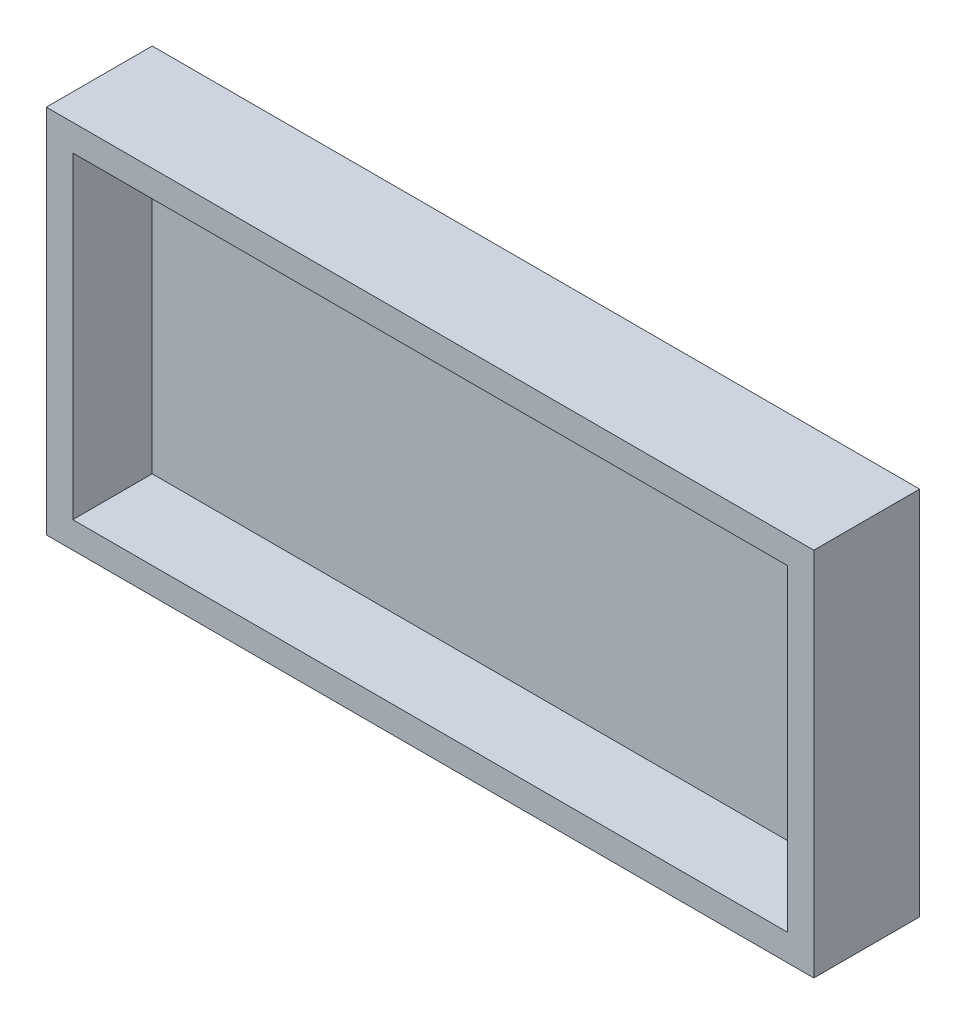
from build123d import *

# Parameters (mm, degrees)
CROQUIS1_W              = 58
CROQUIS1_H              = 28
SALIENTE_EXTRUIR1_DEPTH = 2
CROQUIS2_W              = 58
CROQUIS2_H              = 28
CROQUIS2_W_2            = 54
CROQUIS2_H_2            = 24
SALIENTE_EXTRUIR2_DEPTH = 6


with BuildPart() as part:
    # Croquis1 → Saliente-Extruir1 (new body)
    with BuildSketch(Plane.XY):
        Rectangle(CROQUIS1_W, CROQUIS1_H)
    extrude(amount=SALIENTE_EXTRUIR1_DEPTH)

    # Croquis2 → Saliente-Extruir2 (add)
    with BuildSketch(Plane.XY.offset(2)):
        Rectangle(CROQUIS2_W, CROQUIS2_H)
        Rectangle(CROQUIS2_W_2, CROQUIS2_H_2, mode=Mode.SUBTRACT)
    extrude(amount=SALIENTE_EXTRUIR2_DEPTH)


solid = part.part
